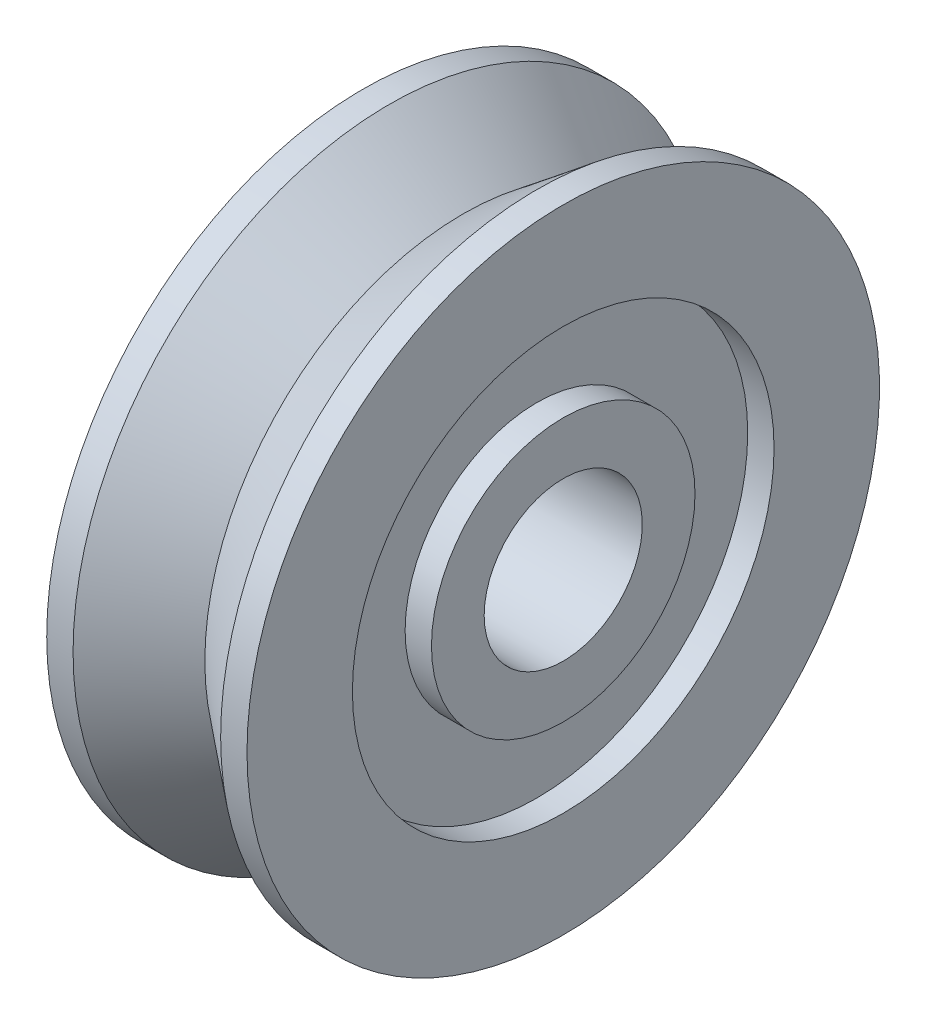
from build123d import *


with BuildPart() as part:
    # 草图1 → 旋转1 (revolve)
    with BuildSketch(Plane.XY, mode=Mode.PRIVATE) as revolve_1_sk:
        Polygon((-1.9, 1.5), (1.9, 1.5), (1.9, 2.5), (1.4, 2.5), (1.4, 4), (1.9, 4), (1.9, 6), (1.4, 6), (0, 4.9), (-1.4, 6), (-1.9, 6), (-1.9, 4), (-1.4, 4), (-1.4, 2.5), (-1.9, 2.5), align=None)
    revolve(revolve_1_sk.sketch.rotate(Axis((0, 0, 0), (1, 0, 0)), 90), axis=Axis((0, 0, 0), (1, 0, 0)))


solid = part.part
